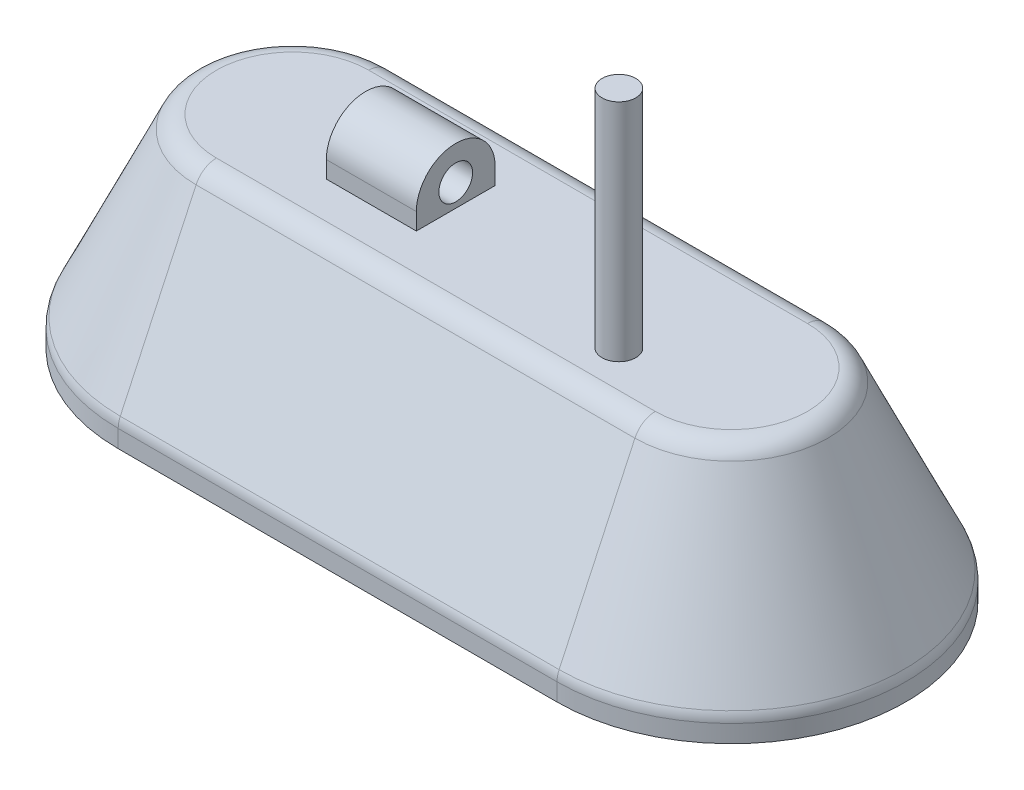
from build123d import *
from OCP.BRepFilletAPI import BRepFilletAPI_MakeChamfer

# Parameters (mm, degrees)
BOSS_EXTRUDE1_DEPTH = 18
SKETCH2_R           = 1.5
BOSS_EXTRUDE2_DEPTH = 20
SKETCH3_W           = 8
SKETCH3_H           = 7
BOSS_EXTRUDE3_DEPTH = 5
SKETCH4_R           = 1.5
CUT_EXTRUDE1_DEPTH  = 10
CHAMFER1_SIZE       = 16
CHAMFER1_SIZE2      = 7.46092253
FILLET3_R           = 2


with BuildPart() as part:
    # Sketch1 → Boss-Extrude1 (new body)
    with BuildSketch(Plane(origin=(0, 0, 0), x_dir=(1, 0, 0), z_dir=(0, 1, 0))):
        with BuildLine():
            Line((0, 0), (-39, 0))
            ThreePointArc((-39, 0), (-54.5, 15.5), (-39, 31))
            Line((-39, 31), (0, 31))
            ThreePointArc((0, 31), (15.5, 15.5), (0, 0))
        make_face()
    extrude(amount=BOSS_EXTRUDE1_DEPTH)

    # Sketch2 → Boss-Extrude2 (add)
    with BuildSketch(Plane(origin=(0, 18, 0), x_dir=(1, 0, 0), z_dir=(0, 1, 0))):
        with Locations(Location((-6.5, 12, 0), (0, 0, 90))):
            Circle(SKETCH2_R)
    extrude(amount=BOSS_EXTRUDE2_DEPTH)

    # Sketch3 → Boss-Extrude3 (add)
    with BuildSketch(Plane(origin=(0, 18, 0), x_dir=(1, 0, 0), z_dir=(0, 1, 0))):
        with Locations((-28.5, 15.5)):
            Rectangle(SKETCH3_W, SKETCH3_H)
    extrude(amount=BOSS_EXTRUDE3_DEPTH)

    # Sketch4 → Cut-Extrude1 (cut)
    with BuildSketch(Plane.ZY.offset(32.5)):
        with Locations((-15.5, 20)):
            Circle(SKETCH4_R)
        with BuildLine():
            Line((-19, 19.5), (-19, 26.550877956))
            Line((-19, 26.550877956), (-12, 26.550877956))
            Line((-12, 26.550877956), (-12, 19.5))
            ThreePointArc((-12, 19.5), (-15.5, 23), (-19, 19.5))
        make_face()
    extrude(amount=-CUT_EXTRUDE1_DEPTH, mode=Mode.SUBTRACT)

    # Chamfer1: one chamfer whose edges measure the first distance from different faces: ONE call of the kernel's chamfer builder (chamfer() names one face for all edges)
    chamfer1_edges_1 = [part.edges().sort_by_distance(p)[0] for p in [
        (-54.5, 18, -15.5),
    ]]
    chamfer1_side_1 = [part.faces().sort_by_distance(p)[0] for p in [
        (-54.5, 9, -15.5),
    ]]
    chamfer1_edges_2 = [part.edges().sort_by_distance(p)[0] for p in [
        (-19.5, 18, 0),
    ]]
    chamfer1_side_2 = [part.faces().sort_by_distance(p)[0] for p in [
        (-19.5, 9, 0),
    ]]
    chamfer1_edges_3 = [part.edges().sort_by_distance(p)[0] for p in [
        (15.5, 18, -15.5),
    ]]
    chamfer1_side_3 = [part.faces().sort_by_distance(p)[0] for p in [
        (15.5, 9, -15.5),
    ]]
    chamfer1_edges_4 = [part.edges().sort_by_distance(p)[0] for p in [
        (-19.5, 18, -31),
    ]]
    chamfer1_side_4 = [part.faces().sort_by_distance(p)[0] for p in [
        (-19.5, 9, -31),
    ]]
    chamfer1 = BRepFilletAPI_MakeChamfer(part.part.solid().wrapped)
    for e in chamfer1_edges_1:
        chamfer1.Add(CHAMFER1_SIZE, CHAMFER1_SIZE2, e.wrapped, chamfer1_side_1[0].wrapped)  # the first distance lies on this face
    for e in chamfer1_edges_2:
        chamfer1.Add(CHAMFER1_SIZE, CHAMFER1_SIZE2, e.wrapped, chamfer1_side_2[0].wrapped)  # the first distance lies on this face
    for e in chamfer1_edges_3:
        chamfer1.Add(CHAMFER1_SIZE, CHAMFER1_SIZE2, e.wrapped, chamfer1_side_3[0].wrapped)  # the first distance lies on this face
    for e in chamfer1_edges_4:
        chamfer1.Add(CHAMFER1_SIZE, CHAMFER1_SIZE2, e.wrapped, chamfer1_side_4[0].wrapped)  # the first distance lies on this face
    add(Compound.cast(chamfer1.Shape()), mode=Mode.REPLACE)

    # Fillet3
    fillet3_edges = [part.edges().sort_by_distance(p)[0] for p in [
        (-19.5, 18, -23.53907747),
        (-47.03907747, 18, -15.5),
        (8.03907747, 18, -15.5),
        (-19.5, 18, -7.46092253),
        (-19.5, 2, 0),
        (15.5, 2, -15.5),
        (-54.5, 2, -15.5),
        (-19.5, 2, -31),
    ]]
    fillet(fillet3_edges, radius=FILLET3_R)


solid = part.part
